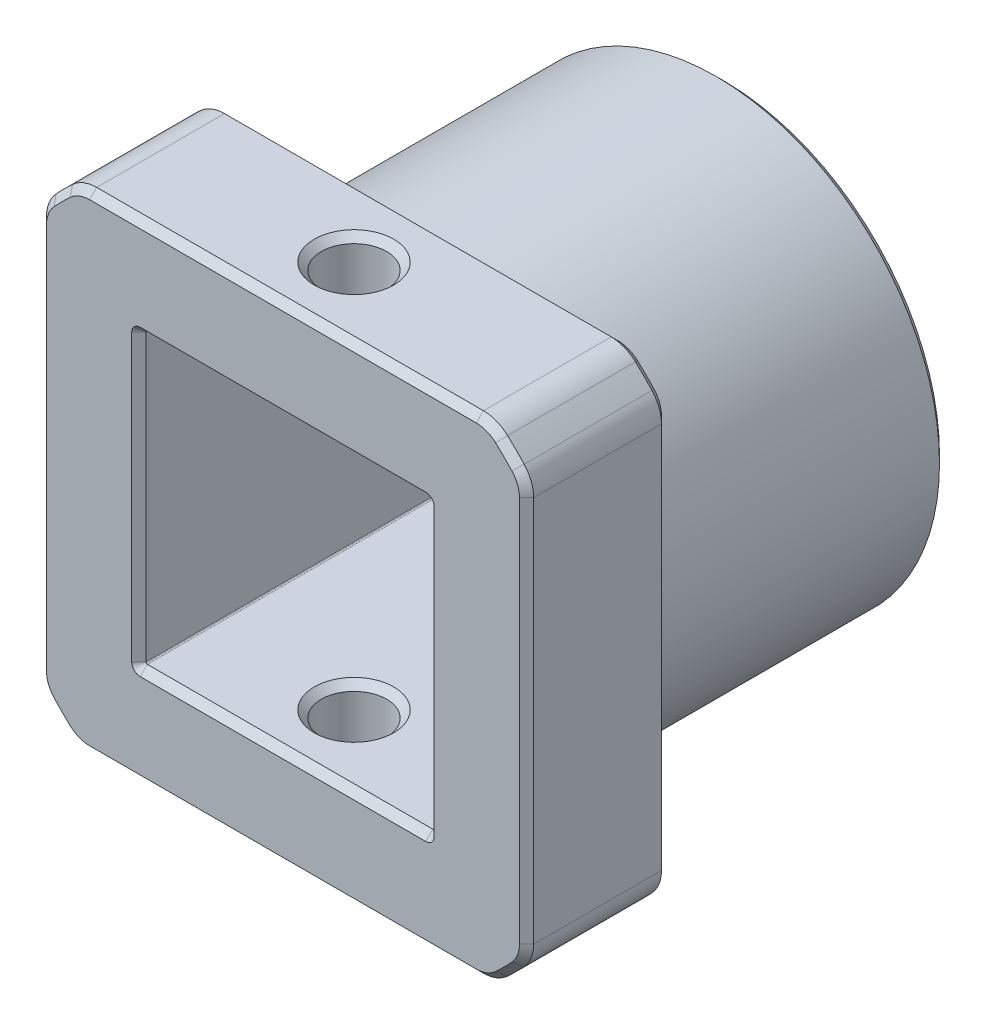
from build123d import *

# Parameters (mm, degrees)
SKIZZE1_R                       = 15.725
SKIZZE1_W                       = 20.3
SKIZZE1_H                       = 20.3
AUFSATZ_LINEAR_AUSTRAGEN1_DEPTH = 21
SKIZZE2_W                       = 20.3
SKIZZE2_H                       = 20.3
AUFSATZ_LINEAR_AUSTRAGEN2_DEPTH = 10
SKIZZE3_R                       = 2.3
SCHNITT_LINEAR_AUSTRAGEN1_DEPTH = 50.311383067
VERRUNDUNG1_R                   = 0.1
VERRUNDUNG2_R                   = 2.5
FASE1_SIZE                      = 0.5
FASE4_SIZE                      = 0.5


with BuildPart() as part:
    # Skizze1 → Aufsatz-Linear austragen1 (new body)
    with BuildSketch(Plane.XY):
        with Locations(Location((0, 0, 0), (0, 0, 180))):
            Circle(SKIZZE1_R)
        Rectangle(SKIZZE1_W, SKIZZE1_H, mode=Mode.SUBTRACT)
    extrude(amount=AUFSATZ_LINEAR_AUSTRAGEN1_DEPTH)

    # Skizze2 → Aufsatz-Linear austragen2 (add)
    with BuildSketch(Plane.XY.offset(21)):
        with BuildLine():
            Line((-14.564597488, 17.15), (14.564597488, 17.15))
            ThreePointArc((14.564597488, 17.15), (15.909902577, 15.909902577), (17.15, 14.564597488))
            Line((17.15, 14.564597488), (17.15, -14.564597488))
            ThreePointArc((17.15, -14.564597488), (15.909902577, -15.909902577), (14.564597488, -17.15))
            Line((14.564597488, -17.15), (-14.564597488, -17.15))
            ThreePointArc((-14.564597488, -17.15), (-15.909902577, -15.909902577), (-17.15, -14.564597488))
            Line((-17.15, -14.564597488), (-17.15, 14.564597488))
            ThreePointArc((-17.15, 14.564597488), (-15.909902577, 15.909902577), (-14.564597488, 17.15))
        make_face()
        Rectangle(SKIZZE2_W, SKIZZE2_H, mode=Mode.SUBTRACT)
    extrude(amount=AUFSATZ_LINEAR_AUSTRAGEN2_DEPTH)

    # Skizze3 → Schnitt-Linear austragen1 (cut, through all)
    with BuildSketch(Plane(origin=(0, 17.15, 0), x_dir=(1, 0, 0), z_dir=(0, 1, 0))):
        with Locations(Location((0, -26, 0), (0, 0, 270))):
            Circle(SKIZZE3_R)
    extrude(amount=-SCHNITT_LINEAR_AUSTRAGEN1_DEPTH, mode=Mode.SUBTRACT)

    # Verrundung1
    verrundung1_edges = [part.edges().sort_by_distance(p)[0] for p in [
        (10.15, -10.15, 15.5),
        (10.15, 10.15, 15.5),
        (-10.15, 10.15, 15.5),
        (-10.15, -10.15, 15.5),
    ]]
    fillet(verrundung1_edges, radius=VERRUNDUNG1_R)

    # Verrundung2
    verrundung2_edges = [part.edges().sort_by_distance(p)[0] for p in [
        (-14.564597488, 17.15, 26),
        (-17.15, 14.564597488, 26),
        (-17.15, -14.564597488, 26),
        (-14.564597488, -17.15, 26),
        (14.564597488, -17.15, 26),
        (17.15, -14.564597488, 26),
        (17.15, 14.564597488, 26),
        (14.564597488, 17.15, 26),
    ]]
    fillet(verrundung2_edges, radius=VERRUNDUNG2_R)

    # Fase1
    fase1_edges = [part.edges().sort_by_distance(p)[0] for p in [
        (-17.15, 0, 31),
        (-15.909902577, 15.909902577, 31),
        (0, -17.15, 31),
        (15.909902577, -15.909902577, 31),
        (17.15, 0, 31),
        (15.909902577, 15.909902577, 31),
        (0, 17.15, 31),
        (-14.52963679, 16.976813809, 31),
        (-16.976813809, 14.52963679, 31),
        (14.52963679, 16.976813809, 31),
        (16.976813809, 14.52963679, 31),
        (16.976813809, -14.52963679, 31),
        (14.52963679, -16.976813809, 31),
        (-14.52963679, -16.976813809, 31),
        (-16.976813809, -14.52963679, 31),
        (15.725, 0, 0),
        (0, -10.15, 23.7),
        (0, 10.15, 23.7),
        (0, -17.15, 23.7),
        (0, 17.15, 23.7),
        (0, -10.15, 0),
        (0, -10.15, 31),
        (10.15, 0, 0),
        (10.15, 0, 31),
        (-10.15, 0, 0),
        (-10.15, 0, 31),
        (0, 10.15, 0),
        (0, 10.15, 31),
        (10.120710678, -10.120710678, 0),
        (10.120710678, -10.120710678, 31),
        (-10.120710678, -10.120710678, 0),
        (-10.120710678, -10.120710678, 31),
        (-10.120710678, 10.120710678, 0),
        (-10.120710678, 10.120710678, 31),
        (10.120710678, 10.120710678, 0),
        (10.120710678, 10.120710678, 31),
        (-15.909902577, -15.909902577, 31),
    ]]
    chamfer(fase1_edges, length=FASE1_SIZE)

    # Fase4
    fase4_edges = [part.edges().sort_by_distance(p)[0] for p in [
        (-16.976813809, -14.52963679, 21),
        (-15.909902577, -15.909902577, 21),
        (-15.909902577, 15.909902577, 21),
        (0, 17.15, 21),
        (15.909902577, 15.909902577, 21),
        (17.15, 0, 21),
        (15.909902577, -15.909902577, 21),
        (0, -17.15, 21),
        (-17.15, 0, 21),
        (-14.52963679, 16.976813809, 21),
        (-16.976813809, 14.52963679, 21),
        (14.52963679, 16.976813809, 21),
        (16.976813809, 14.52963679, 21),
        (16.976813809, -14.52963679, 21),
        (14.52963679, -16.976813809, 21),
        (-14.52963679, -16.976813809, 21),
    ]]
    chamfer(fase4_edges, length=FASE4_SIZE)


solid = part.part
